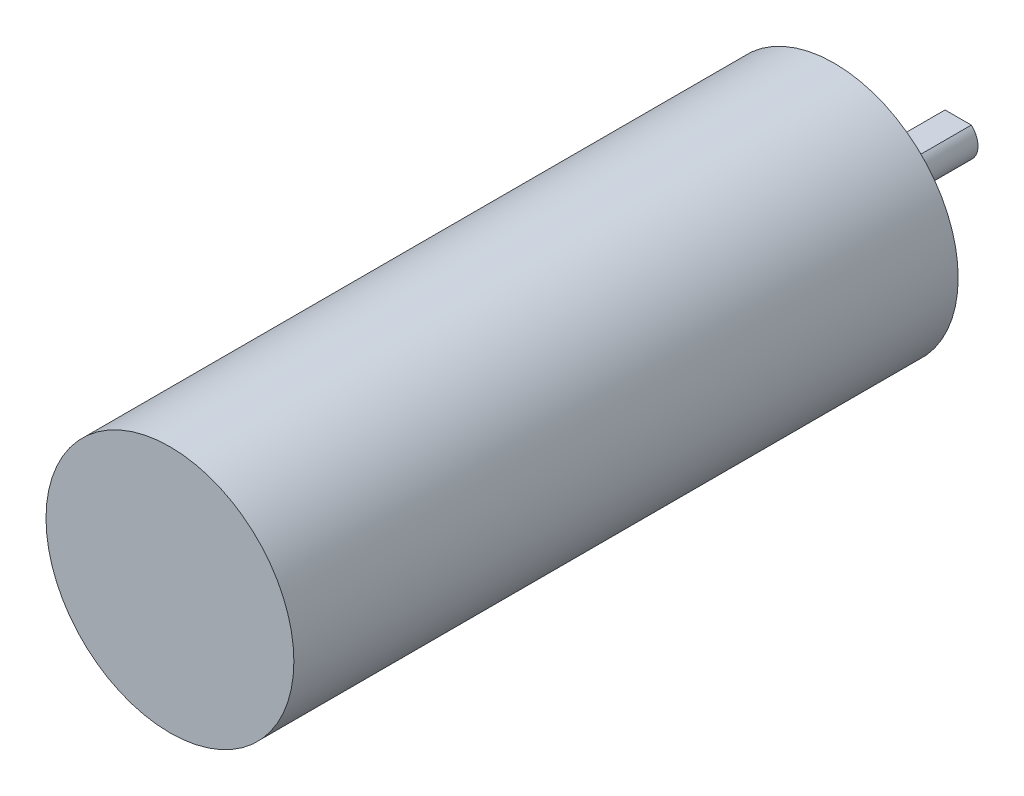
from build123d import *

# Parameters (mm, degrees)
SKETCH1_R           = 12.5
BOSS_EXTRUDE1_DEPTH = 67
SKETCH2_R           = 3.5
BOSS_EXTRUDE2_DEPTH = 2.5
BOSS_EXTRUDE3_DEPTH = 10
SKETCH4_R           = 1.5
CUT_EXTRUDE1_DEPTH  = 12.7


with BuildPart() as part:
    # Sketch1 → Boss-Extrude1 (new body)
    with BuildSketch(Plane.XY):
        Circle(SKETCH1_R)
    extrude(amount=BOSS_EXTRUDE1_DEPTH)

    # Sketch2 → Boss-Extrude2 (add)
    with BuildSketch(Plane(origin=(0, 0, 0), x_dir=(-1, 0, 0), z_dir=(0, 0, -1))):
        Circle(SKETCH2_R)
    extrude(amount=BOSS_EXTRUDE2_DEPTH)

    # Sketch3 → Boss-Extrude3 (add)
    with BuildSketch(Plane(origin=(0, 0, -2.5), x_dir=(-1, 0, 0), z_dir=(0, 0, -1))):
        with BuildLine():
            Line((-1.322875656, 1.5), (1.322875656, 1.5))
            ThreePointArc((1.322875656, 1.5), (0, -2), (-1.322875656, 1.5))
        make_face()
    extrude(amount=BOSS_EXTRUDE3_DEPTH)

    # Sketch4 → Cut-Extrude1 (cut)
    with BuildSketch(Plane(origin=(0, 0, 0), x_dir=(-1, 0, 0), z_dir=(0, 0, -1))):
        with Locations((0, 8.5)):
            Circle(SKETCH4_R)
    cut_extrude1 = extrude(amount=-CUT_EXTRUDE1_DEPTH, mode=Mode.SUBTRACT)

    # Mirror1: Cut-Extrude1 across plane
    add(cut_extrude1.mirror(Plane.ZX), mode=Mode.SUBTRACT)


solid = part.part
